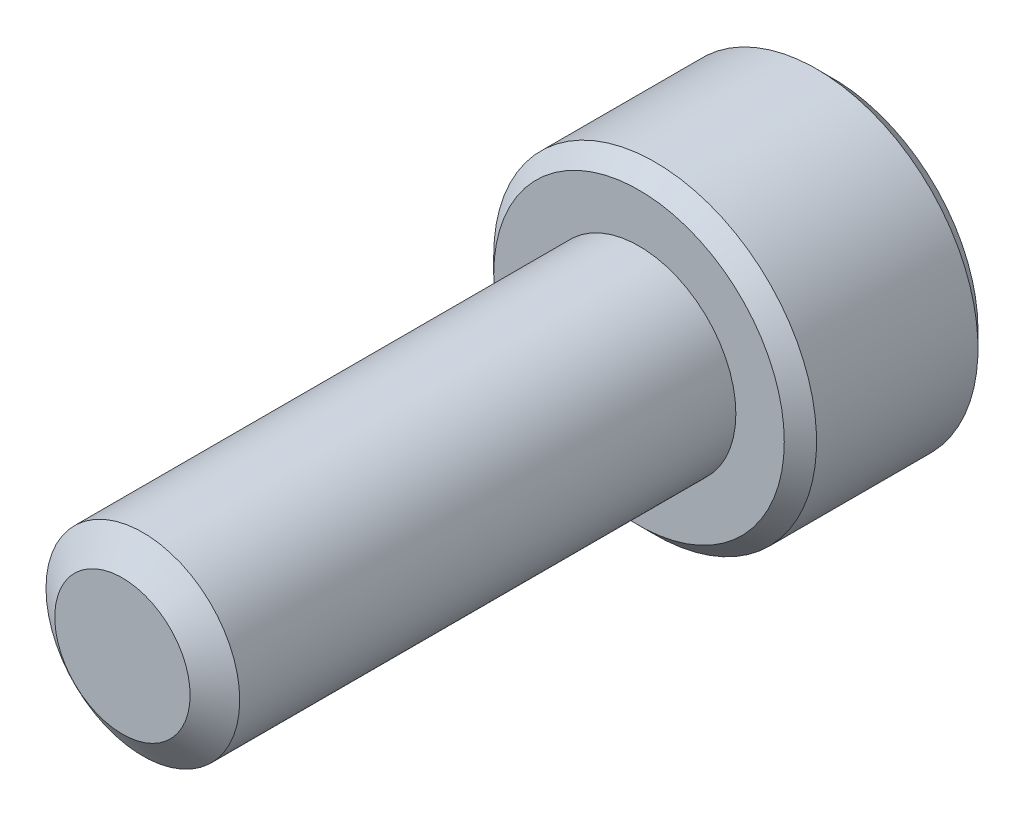
from build123d import *

# Parameters (mm, degrees)
SKETCH1_R          = 3
EXTRUDE1_DEPTH     = 16
SKETCH6_R          = 5
EXTRUDE2_DEPTH     = 6
CUT_EXTRUDE1_DEPTH = 3.75
CHAMFER1_SIZE      = 0.5


with BuildPart() as part:
    # Sketch1 → Extrude1 (new body)
    with BuildSketch(Plane.XY):
        Circle(SKETCH1_R)
    extrude(amount=-EXTRUDE1_DEPTH)

    # Sketch4 → Cut-Revolve1 (revolve, cut)
    with BuildSketch(Plane(origin=(0, 0, 0), x_dir=(0, 0, -1), z_dir=(1, 0, 0))):
        Polygon((0.632650852, 3), (0, 2.096480947), (0, 3), align=None)
    revolve(axis=Axis((0, 0, 0), (0, 0, -1)), mode=Mode.SUBTRACT)

    # Sketch6 → Extrude2 (add)
    with BuildSketch(Plane(origin=(0, 0, -16), x_dir=(-1, 0, 0), z_dir=(0, 0, -1))):
        Circle(SKETCH6_R)
    extrude(amount=EXTRUDE2_DEPTH)

    # Sketch7 → Cut-Extrude1 (cut)
    with BuildSketch(Plane(origin=(0, 0, -22), x_dir=(-1, 0, 0), z_dir=(0, 0, -1))):
        Polygon((0, 2.886751346), (-2.5, 1.443375673), (-2.5, -1.443375673), (0, -2.886751346), (2.5, -1.443375673), (2.5, 1.443375673), align=None)
    extrude(amount=-CUT_EXTRUDE1_DEPTH, mode=Mode.SUBTRACT)

    # Chamfer1
    chamfer1_edges = [part.edges().sort_by_distance(p)[0] for p in [
        (5, 0, -22),
        (5, 0, -16),
    ]]
    chamfer(chamfer1_edges, length=CHAMFER1_SIZE)


solid = part.part
